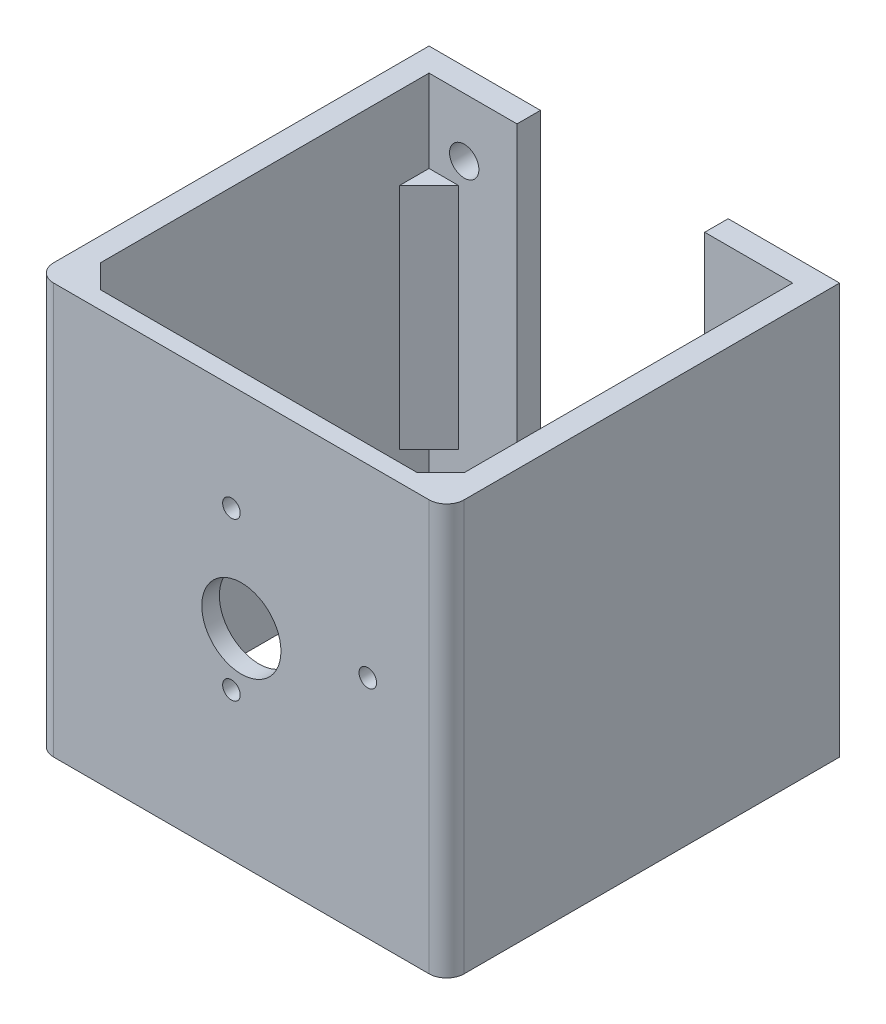
from build123d import *

# Parameters (mm, degrees)
SKETCH1_W                = 70
SKETCH1_H                = 70
BOSS_EXTRUDE2_DEPTH      = 3
SKETCH2_R                = 6.75
SKETCH2_R_2              = 1.5
CUT_EXTRUDE1_DEPTH       = 4
SKETCH3_W                = 64
SKETCH3_H                = 70
BOSS_EXTRUDE3_DEPTH      = 4
SKETCH4_W                = 64
SKETCH4_H                = 70
BOSS_EXTRUDE4_DEPTH      = 4
SKETCH5_W                = 15
SKETCH5_H                = 70
BOSS_EXTRUDE5_DEPTH      = 4
SKETCH6_R                = 2.5
CUT_EXTRUDE2_DEPTH       = 4
BOSS_EXTRUDE6_DEPTH      = 70
BOSS_EXTRUDE7_DEPTH      = 20
BOSS_EXTRUDE7_DEPTH_BACK = 19
FILLET1_R                = 3


with BuildPart() as part:
    # Sketch1 → Boss-Extrude2 (new body)
    with BuildSketch(Plane.XY):
        with Locations((-9.605752423, -0.918004132)):
            Rectangle(SKETCH1_W, SKETCH1_H)
    extrude(amount=BOSS_EXTRUDE2_DEPTH)

    # Sketch2 → Cut-Extrude1 (cut)
    with BuildSketch(Plane.XY.offset(3)):
        with Locations((-9.605752423, -0.918004132)):
            Circle(SKETCH2_R)
        with Locations((-11.293574597, 16.005389627)):
            Circle(SKETCH2_R_2)
        with Locations((11.956425403, 2.581995868)):
            Circle(SKETCH2_R_2)
        with Locations((-11.293574597, -10.84139789)):
            Circle(SKETCH2_R_2)
    extrude(amount=-CUT_EXTRUDE1_DEPTH, mode=Mode.SUBTRACT)

    # Sketch3 → Boss-Extrude3 (add)
    with BuildSketch(Plane(origin=(25.394247577, 0, 0), x_dir=(0, 0, -1), z_dir=(1, 0, 0))):
        with Locations((32, -0.918004132)):
            Rectangle(SKETCH3_W, SKETCH3_H)
    extrude(amount=-BOSS_EXTRUDE3_DEPTH)

    # Sketch4 → Boss-Extrude4 (add)
    with BuildSketch(Plane.ZY.offset(44.605752423)):
        with Locations((-32, -0.918004132)):
            Rectangle(SKETCH4_W, SKETCH4_H)
    extrude(amount=-BOSS_EXTRUDE4_DEPTH)

    # Sketch5 → Boss-Extrude5 (add)
    with BuildSketch(Plane(origin=(0, 0, -64), x_dir=(-1, 0, 0), z_dir=(0, 0, -1))):
        with Locations((-13.894247577, -0.918004132)):
            Rectangle(SKETCH5_W, SKETCH5_H)
        with Locations((33.105752423, -0.918004132)):
            Rectangle(SKETCH5_W, SKETCH5_H)
    extrude(amount=-BOSS_EXTRUDE5_DEPTH)

    # Sketch6 → Cut-Extrude2 (cut)
    with BuildSketch(Plane(origin=(0, 0, -64), x_dir=(-1, 0, 0), z_dir=(0, 0, -1))):
        with Locations((-15.394247577, 24.081995868)):
            Circle(SKETCH6_R)
        with Locations((-15.394247577, -25.918004132)):
            Circle(SKETCH6_R)
        with Locations((34.605752423, 24.081995868)):
            Circle(SKETCH6_R)
        with Locations((34.605752423, -25.918004132)):
            Circle(SKETCH6_R)
    extrude(amount=-CUT_EXTRUDE2_DEPTH, mode=Mode.SUBTRACT)

    # Sketch7 → Boss-Extrude6 (add)
    with BuildSketch(Plane(origin=(0, 34.081995868, 0), x_dir=(1, 0, 0), z_dir=(0, 1, 0))):
        Polygon((-40.605752423, 0), (-40.605752423, 4), (-36.605752423, 0), align=None)
        Polygon((21.394247577, 0), (21.394247577, 4), (17.394247577, 0), align=None)
    extrude(amount=-BOSS_EXTRUDE6_DEPTH)

    # Sketch8 → Boss-Extrude7 (add, two sides: drawn at the far end of the back side and taken through both)
    with BuildSketch(Plane(origin=(0, 0, 0), x_dir=(1, 0, 0), z_dir=(0, 1, 0)).offset(-BOSS_EXTRUDE7_DEPTH_BACK)):
        Polygon((-40.605752423, 60), (-35.605752423, 60), (-40.605752423, 55), align=None)
        Polygon((21.394247577, 60), (16.394247577, 60), (21.394247577, 55), align=None)
    extrude(amount=BOSS_EXTRUDE7_DEPTH + BOSS_EXTRUDE7_DEPTH_BACK)

    # Fillet1
    fillet1_edges = [part.edges().sort_by_distance(p)[0] for p in [
        (25.394247577, -0.918004132, 3),
        (-44.605752423, -0.918004132, 3),
    ]]
    fillet(fillet1_edges, radius=FILLET1_R)


solid = part.part
